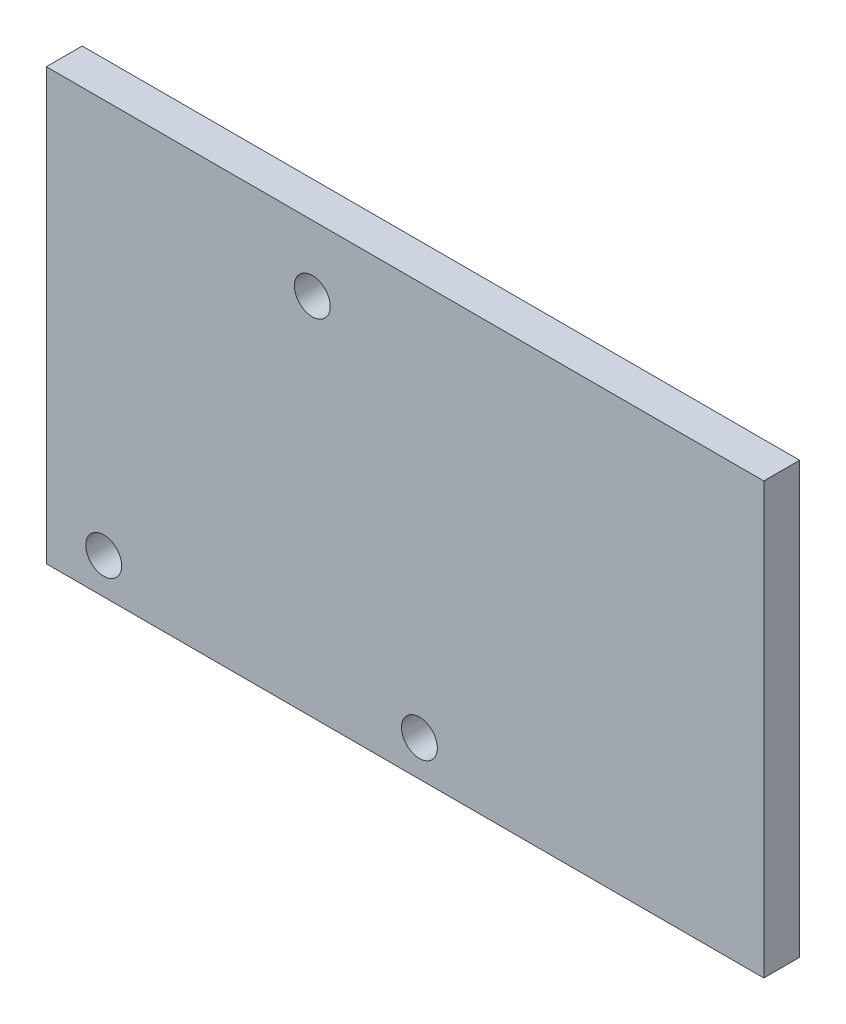
from build123d import *

# Parameters (mm, degrees)
SKETCH1_W                             = 127
SKETCH1_H                             = 76.2
BOSS_EXTRUDE1_DEPTH                   = 6.35
CUT_EXTRUDE1_DEPTH                    = 149.24224263
CUT_EXTRUDE1_DEPTH_BACK               = 149.24224263
SKETCH4_R                             = 3.175
F_1_4_0_25_DIAMETER_HOLE1_D           = 6.35
F_1_4_0_25_DIAMETER_HOLE1_CSINK_D     = 7.62
F_1_4_0_25_DIAMETER_HOLE1_CSINK_ANGLE = 90


with BuildPart() as part:
    # Sketch1 → Boss-Extrude1 (new body)
    with BuildSketch(Plane.XY):
        with Locations((-63.5, 38.1)):
            Rectangle(SKETCH1_W, SKETCH1_H)
    extrude(amount=BOSS_EXTRUDE1_DEPTH)

    # Sketch4 → Cut-Extrude1 (cut, two sides: drawn at the far end of the back side and taken through both)
    with BuildSketch(Plane(origin=(0, 0, 0), x_dir=(-1, 0, 0), z_dir=(0, 0, -1)).offset(-CUT_EXTRUDE1_DEPTH_BACK)):
        with Locations((79.912500047, 64.573038165)):
            Circle(SKETCH4_R)
    extrude(amount=CUT_EXTRUDE1_DEPTH + CUT_EXTRUDE1_DEPTH_BACK, mode=Mode.SUBTRACT)

    # 1/4 (0.25) Diameter Hole1 (through all)
    with Locations(Plane(origin=(0, 0, 0), x_dir=(-1, 0, 0), z_dir=(0, 0, -1))):
        with Locations((116.84, 6.35), (60.96, 6.35)):
            CounterSinkHole(F_1_4_0_25_DIAMETER_HOLE1_D / 2, F_1_4_0_25_DIAMETER_HOLE1_CSINK_D / 2, counter_sink_angle=F_1_4_0_25_DIAMETER_HOLE1_CSINK_ANGLE)


solid = part.part
